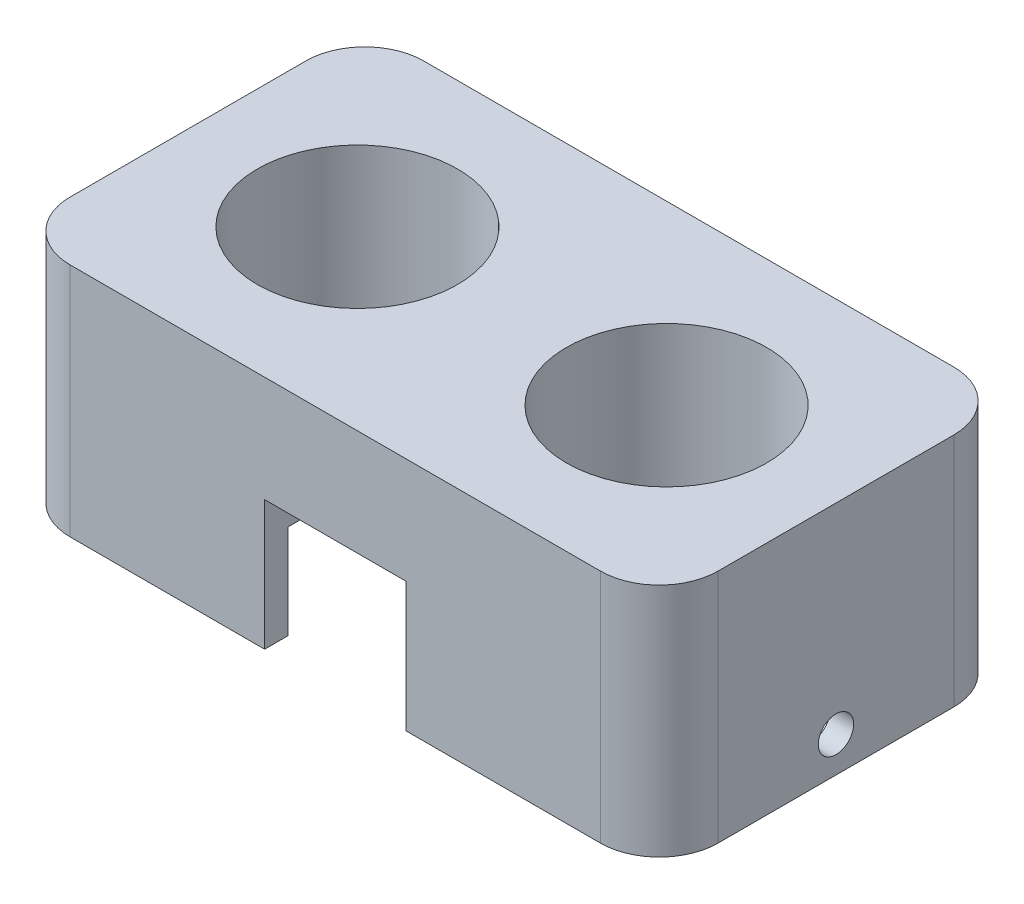
from build123d import *

# Parameters (mm, degrees)
SKETCH1_W             = 55
SKETCH1_H             = 30
BOSS_EXTRUDE1_DEPTH   = 12
SKETCH2_R             = 8.5
CUT_EXTRUDE1_DEPTH    = 34.544746235
SKETCH4_W             = 12
SKETCH4_H             = 5
CUT_EXTRUDE2_DEPTH    = 5
FILLET1_R             = 2
SKETCH5_W             = 12
SKETCH5_H             = 5
CUT_EXTRUDE3_DEPTH    = 3
FILLET2_R             = 5
BOSS_EXTRUDE3_DEPTH   = 8
F_3_0MM_DOWEL_HOLE1_D = 3


with BuildPart() as part:
    # Sketch1 → Boss-Extrude1 (new body)
    with BuildSketch(Plane(origin=(0, 0, 0), x_dir=(1, 0, 0), z_dir=(0, 1, 0))):
        Rectangle(SKETCH1_W, SKETCH1_H)
    extrude(amount=BOSS_EXTRUDE1_DEPTH)

    # Sketch2 → Cut-Extrude1 (cut, through all)
    with BuildSketch(Plane(origin=(0, 12, 0), x_dir=(1, 0, 0), z_dir=(0, 1, 0))):
        with Locations(Location((-13.12, 0, 0), (0, 0, 270))):
            Circle(SKETCH2_R)
        with Locations(Location((13.12, 0, 0), (0, 0, 270))):
            Circle(SKETCH2_R)
    extrude(amount=-CUT_EXTRUDE1_DEPTH, mode=Mode.SUBTRACT)

    # Sketch4 → Cut-Extrude2 (cut)
    with BuildSketch(Plane.XZ):
        with Locations((0, -10)):
            Rectangle(SKETCH4_W, SKETCH4_H)
    extrude(amount=-CUT_EXTRUDE2_DEPTH, mode=Mode.SUBTRACT)

    # Fillet1
    fillet1_edges = [part.edges().sort_by_distance(p)[0] for p in [
        (-6, 2.5, -12.5),
        (-6, 2.5, -7.5),
        (6, 2.5, -7.5),
        (6, 2.5, -12.5),
    ]]
    fillet(fillet1_edges, radius=FILLET1_R)

    # Sketch5 → Cut-Extrude3 (cut)
    with BuildSketch(Plane.XZ):
        with Locations((0, 12.5)):
            Rectangle(SKETCH5_W, SKETCH5_H)
    extrude(amount=-CUT_EXTRUDE3_DEPTH, mode=Mode.SUBTRACT)

    # Fillet2
    fillet2_edges = [part.edges().sort_by_distance(p)[0] for p in [
        (27.5, 6, 15),
        (-27.5, 6, 15),
        (-27.5, 6, -15),
        (27.5, 6, -15),
    ]]
    fillet(fillet2_edges, radius=FILLET2_R)

    # Sketch6 → Boss-Extrude3 (add)
    with BuildSketch(Plane.XZ):
        with BuildLine():
            Line((25.5, 10), (25.5, -10))
            ThreePointArc((25.5, -10), (24.621320344, -12.121320344), (22.5, -13))
            Line((22.5, -13), (-22.5, -13))
            ThreePointArc((-22.5, -13), (-24.621320344, -12.121320344), (-25.5, -10))
            Line((-25.5, -10), (-25.5, 10))
            ThreePointArc((-25.5, 10), (-24.621320344, 12.121320344), (-22.5, 13))
            Line((-22.5, 13), (-8, 13))
            Line((-8, 13), (-6, 13))
            Line((-6, 13), (-6, 15))
            Line((-6, 15), (-22.5, 15))
            ThreePointArc((-22.5, 15), (-26.035533906, 13.535533906), (-27.5, 10))
            Line((-27.5, 10), (-27.5, -10))
            ThreePointArc((-27.5, -10), (-26.035533906, -13.535533906), (-22.5, -15))
            Line((-22.5, -15), (22.5, -15))
            ThreePointArc((22.5, -15), (26.035533906, -13.535533906), (27.5, -10))
            Line((27.5, -10), (27.5, 10))
            ThreePointArc((27.5, 10), (26.035533906, 13.535533906), (22.5, 15))
            Line((22.5, 15), (6, 15))
            Line((6, 15), (6, 13))
            Line((6, 13), (8, 13))
            Line((8, 13), (22.5, 13))
            ThreePointArc((22.5, 13), (24.621320344, 12.121320344), (25.5, 10))
        make_face()
    extrude(amount=BOSS_EXTRUDE3_DEPTH)

    # Ø3.0mm Dowel Hole1 (through all)
    with Locations(Plane.ZY.offset(27.5)):
        with Locations((0, -5)):
            Hole(F_3_0MM_DOWEL_HOLE1_D / 2)


solid = part.part
